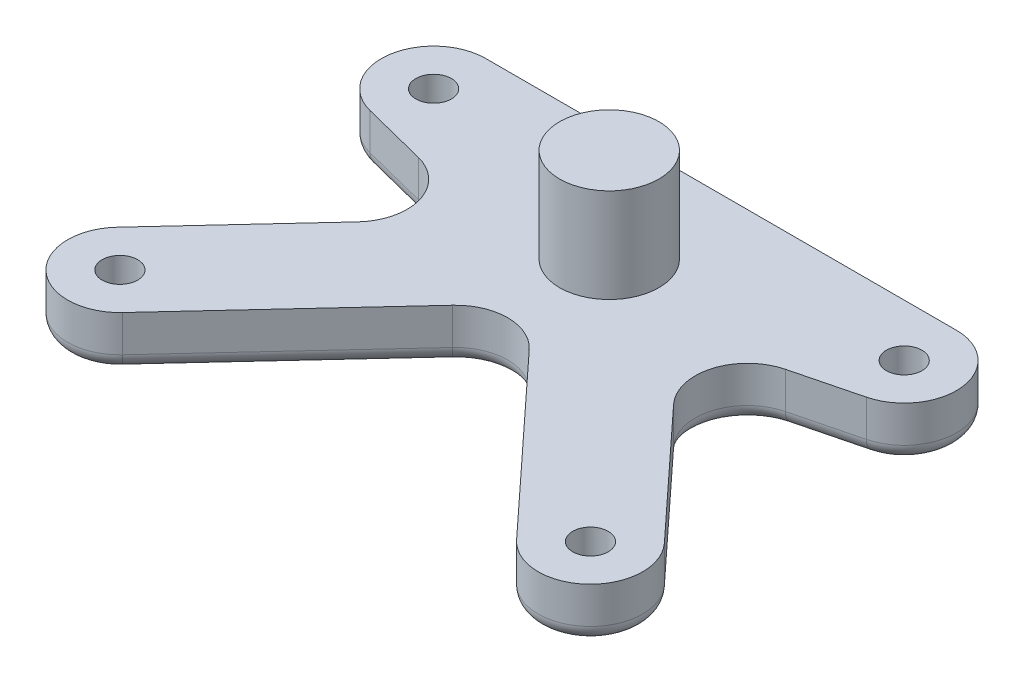
from build123d import *

# Parameters (mm, degrees)
SKETCH1_R           = 1.7
BOSS_EXTRUDE1_DEPTH = 5
SKETCH2_R           = 4.75
BOSS_EXTRUDE2_DEPTH = 9
FILLET1_R           = 1.5


with BuildPart() as part:
    # Sketch1 → Boss-Extrude1 (new body)
    with BuildSketch(Plane(origin=(0, 0, 0), x_dir=(1, 0, 0), z_dir=(0, 1, 0))):
        with BuildLine():
            Line((-26.16880337, -11.602959843), (-15.107142779, 0.343633596))
            ThreePointArc((-15.107142779, 0.343633596), (-13.981683241, 5.160195913), (-17.548068062, 8.58756094))
            Line((-17.548068062, 8.58756094), (-23.727878087, 10.153112813))
            ThreePointArc((-23.727878087, 10.153112813), (-27.461574142, 15.618693812), (-22.5, 20))
            Line((-22.5, 20), (22.5, 20))
            ThreePointArc((22.5, 20), (27.461574142, 15.618693812), (23.727878087, 10.153112813))
            Line((23.727878087, 10.153112813), (17.548068062, 8.58756094))
            ThreePointArc((17.548068062, 8.58756094), (13.981683241, 5.160195913), (15.107142779, 0.343633596))
            Line((15.107142779, 0.343633596), (26.16880337, -11.602959843))
            ThreePointArc((26.16880337, -11.602959843), (25.897040157, -18.66880337), (18.83119663, -18.397040157))
            Line((18.83119663, -18.397040157), (3.66880337, -2.021655437))
            ThreePointArc((3.66880337, -2.021655437), (0, -0.418695594), (-3.66880337, -2.021655437))
            Line((-3.66880337, -2.021655437), (-18.83119663, -18.397040157))
            ThreePointArc((-18.83119663, -18.397040157), (-25.897040157, -18.66880337), (-26.16880337, -11.602959843))
        make_face()
        with Locations(Location((22.5, 15, 0), (0, 0, 270))):
            Circle(SKETCH1_R, mode=Mode.SUBTRACT)
        with Locations(Location((22.5, -15, 0), (0, 0, 270))):
            Circle(SKETCH1_R, mode=Mode.SUBTRACT)
        with Locations(Location((-22.5, 15, 0), (0, 0, 270))):
            Circle(SKETCH1_R, mode=Mode.SUBTRACT)
        with Locations(Location((-22.5, -15, 0), (0, 0, 270))):
            Circle(SKETCH1_R, mode=Mode.SUBTRACT)
    extrude(amount=BOSS_EXTRUDE1_DEPTH)

    # Sketch2 → Boss-Extrude2 (add)
    with BuildSketch(Plane(origin=(0, 5, 0), x_dir=(1, 0, 0), z_dir=(0, 1, 0))):
        with Locations(Location((0, 9.3, 0), (0, 0, 270))):
            Circle(SKETCH2_R)
    extrude(amount=BOSS_EXTRUDE2_DEPTH)

    # Fillet1
    fillet1_edges = [part.edges().sort_by_distance(p)[0] for p in [
        (-20.637973075, 0, 5.629663123),
        (-13.981683241, 0, -5.160195913),
        (-20.637973075, 0, -9.370336877),
        (-27.461574142, 0, -15.618693812),
        (0, 0, -20),
        (27.461574142, 0, -15.618693812),
        (20.637973075, 0, -9.370336877),
        (13.981683241, 0, -5.160195913),
        (20.637973075, 0, 5.629663123),
        (25.897040157, 0, 18.66880337),
        (11.25, 0, 10.209347797),
        (0, 0, 0.418695594),
        (-11.25, 0, 10.209347797),
        (-25.897040157, 0, 18.66880337),
    ]]
    fillet(fillet1_edges, radius=FILLET1_R)


solid = part.part
